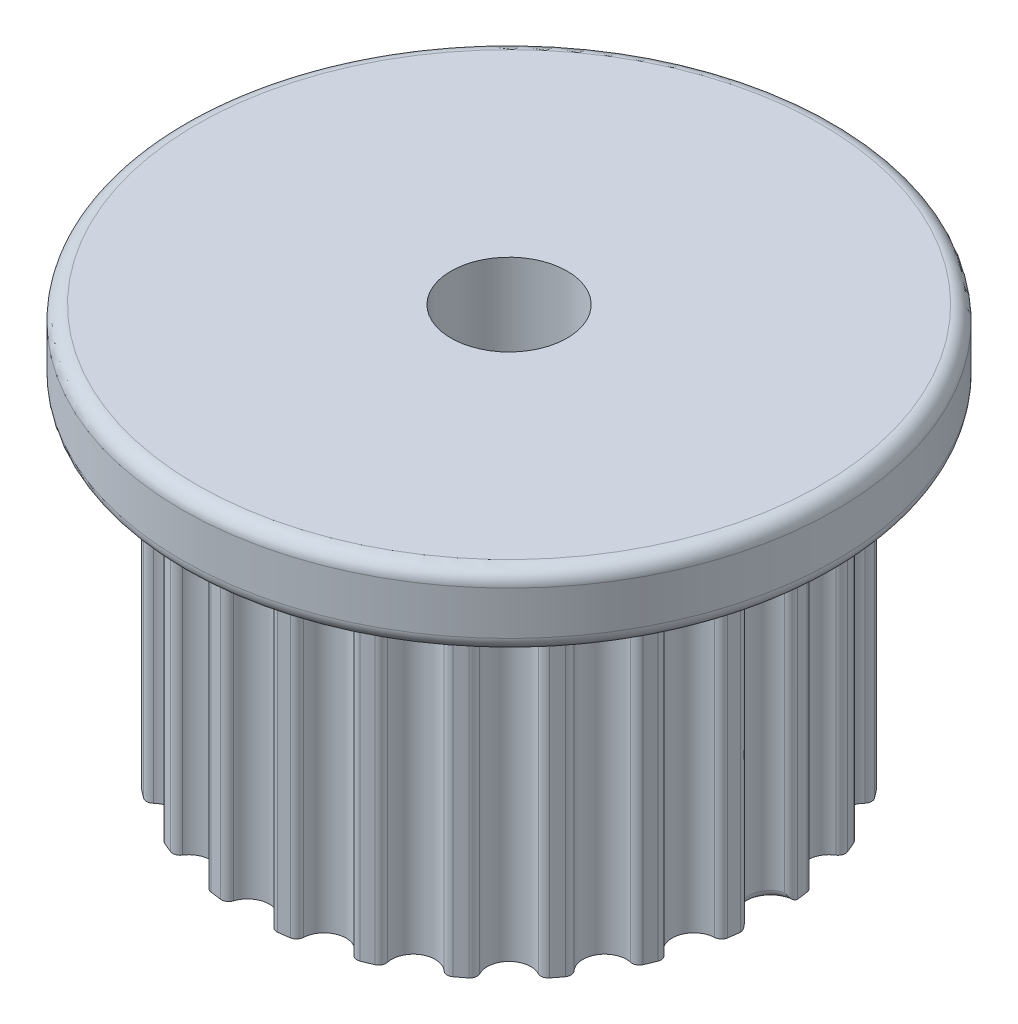
from build123d import *

# Parameters (mm, degrees)
ESBO_O1_R                = 4.5
RESSALTO_EXTRUS_O1_DEPTH = 1
ESBO_O4_R                = 3.6
ESBO_O4_R_2              = 0.8
RESSALTO_EXTRUS_O3_DEPTH = 4.5
ESBO_O5_R                = 0.3
CORTE_EXTRUS_O2_DEPTH    = 4.5
FILETE2_R                = 0.1
ESBO_O6_R                = 0.8
CORTE_EXTRUS_O3_DEPTH    = 8.794228692
FILETE3_R                = 0.2


with BuildPart() as part:
    # Esboço1 → Ressalto-extrusão1 (new body)
    with BuildSketch(Plane(origin=(0, 0, 0), x_dir=(1, 0, 0), z_dir=(0, 1, 0))):
        with Locations(Location((0, 0, 0), (0, 0, 270))):
            Circle(ESBO_O1_R)
    extrude(amount=RESSALTO_EXTRUS_O1_DEPTH)

    # Esboço4 → Ressalto-extrusão3 (add)
    with BuildSketch(Plane.XZ):
        with Locations(Location((0, 0, 0), (0, 0, 90))):
            Circle(ESBO_O4_R)
        with Locations(Location((0, 0, 0), (0, 0, 270))):
            Circle(ESBO_O4_R_2, mode=Mode.SUBTRACT)
    extrude(amount=RESSALTO_EXTRUS_O3_DEPTH)

    # Esboço5 → Corte-extrusão2 (cut)
    with BuildSketch(Plane.XZ.offset(4.5)):
        with Locations((0, 3.6)):
            Circle(ESBO_O5_R)
        with Locations((0.931748562, 3.477332975)):
            Circle(ESBO_O5_R)
        with Locations((1.8, 3.117691454)):
            Circle(ESBO_O5_R)
        with Locations((2.545584412, 2.545584412)):
            Circle(ESBO_O5_R)
        with Locations((3.117691454, 1.8)):
            Circle(ESBO_O5_R)
        with Locations((3.477332975, 0.931748562)):
            Circle(ESBO_O5_R)
        with Locations((3.6, 0)):
            Circle(ESBO_O5_R)
        with Locations((3.477332975, -0.931748562)):
            Circle(ESBO_O5_R)
        with Locations((3.117691454, -1.8)):
            Circle(ESBO_O5_R)
        with Locations((2.545584412, -2.545584412)):
            Circle(ESBO_O5_R)
        with Locations((1.8, -3.117691454)):
            Circle(ESBO_O5_R)
        with Locations((0.931748562, -3.477332975)):
            Circle(ESBO_O5_R)
        with Locations((0, -3.6)):
            Circle(ESBO_O5_R)
        with Locations((-0.931748562, -3.477332975)):
            Circle(ESBO_O5_R)
        with Locations((-1.8, -3.117691454)):
            Circle(ESBO_O5_R)
        with Locations((-2.545584412, -2.545584412)):
            Circle(ESBO_O5_R)
        with Locations((-3.117691454, -1.8)):
            Circle(ESBO_O5_R)
        with Locations((-3.477332975, -0.931748562)):
            Circle(ESBO_O5_R)
        with Locations((-3.6, 0)):
            Circle(ESBO_O5_R)
        with Locations((-3.477332975, 0.931748562)):
            Circle(ESBO_O5_R)
        with Locations((-3.117691454, 1.8)):
            Circle(ESBO_O5_R)
        with Locations((-2.545584412, 2.545584412)):
            Circle(ESBO_O5_R)
        with Locations((-1.8, 3.117691454)):
            Circle(ESBO_O5_R)
        with Locations((-0.931748562, 3.477332975)):
            Circle(ESBO_O5_R)
    extrude(amount=-CORTE_EXTRUS_O2_DEPTH, mode=Mode.SUBTRACT)

    # Filete2
    filete2_edges = [part.edges().sort_by_distance(p)[0] for p in [
        (-2.857883832, 0, -1.65),
        (-2.333452378, 0, -2.333452378),
        (-1.65, 0, -2.857883832),
        (-0.854102849, 0, -3.187555227),
        (0, 0, -3.3),
        (0.854102849, 0, -3.187555227),
        (1.65, 0, -2.857883832),
        (2.333452378, 0, -2.333452378),
        (2.857883832, 0, -1.65),
        (3.187555227, 0, -0.854102849),
        (3.3, -4.5, 0),
        (3.3, 0, 0),
        (3.187555227, 0, 0.854102849),
        (2.857883832, 0, 1.65),
        (2.333452378, 0, 2.333452378),
        (1.65, 0, 2.857883832),
        (0.854102849, 0, 3.187555227),
        (-3.187555227, 0, -0.854102849),
        (-3.3, 0, 0),
        (-3.187555227, 0, 0.854102849),
        (-2.857883832, 0, 1.65),
        (-2.333452378, 0, 2.333452378),
        (-1.65, 0, 2.857883832),
        (-0.854102849, 0, 3.187555227),
        (0, 0, 3.3),
        (-1.377660357, 0, 3.325966317),
        (-2.191541144, 0, 2.856072025),
        (-2.856072025, 0, 2.191541144),
        (-3.325966317, 0, 1.377660357),
        (-3.569201501, 0, 0.469894292),
        (-3.569201501, 0, -0.469894292),
        (-3.325966317, 0, -1.377660357),
        (-2.856072025, 0, -2.191541144),
        (-2.191541144, 0, -2.856072025),
        (-1.377660357, 0, -3.325966317),
        (-0.469894292, 0, -3.569201501),
        (0.469894292, 0, -3.569201501),
        (1.377660357, 0, -3.325966317),
        (2.191541144, 0, -2.856072025),
        (2.856072025, 0, -2.191541144),
        (3.325966317, 0, -1.377660357),
        (3.569201501, 0, -0.469894292),
        (3.569201501, 0, 0.469894292),
        (3.325966317, 0, 1.377660357),
        (2.856072025, 0, 2.191541144),
        (2.191541144, 0, 2.856072025),
        (1.377660357, 0, 3.325966317),
        (0.469894292, 0, 3.569201501),
        (-0.29973947, -2.25, 3.5875),
        (0.29973947, -2.25, 3.5875),
        (-1.21803942, -2.25, 3.387680618),
        (-0.638987229, -2.25, 3.542837185),
        (-2.053331996, -2.25, 2.956996401),
        (-1.534168004, -2.25, 3.256735871),
        (-2.748693389, -2.25, 2.324797766),
        (-2.324797766, -2.25, 2.748693389),
        (-3.256735871, -2.25, 1.534168004),
        (-2.956996401, -2.25, 2.053331996),
        (-3.542837185, -2.25, 0.638987229),
        (-3.387680618, -2.25, 1.21803942),
        (-3.5875, -2.25, -0.29973947),
        (-3.5875, -2.25, 0.29973947),
        (-3.387680618, -2.25, -1.21803942),
        (-3.542837185, -2.25, -0.638987229),
        (0.638987229, -2.25, 3.542837185),
        (1.21803942, -2.25, 3.387680618),
        (1.534168004, -2.25, 3.256735871),
        (2.053331996, -2.25, 2.956996401),
        (2.324797766, -2.25, 2.748693389),
        (2.748693389, -2.25, 2.324797766),
        (2.956996401, -2.25, 2.053331996),
        (3.256735871, -2.25, 1.534168004),
        (3.387680618, -2.25, 1.21803942),
        (3.542837185, -2.25, 0.638987229),
        (3.5875, -2.25, 0.29973947),
        (3.5875, -2.25, -0.29973947),
        (3.542837185, -2.25, -0.638987229),
        (3.387680618, -2.25, -1.21803942),
        (3.256735871, -2.25, -1.534168004),
        (2.956996401, -2.25, -2.053331996),
        (2.748693389, -2.25, -2.324797766),
        (2.324797766, -2.25, -2.748693389),
        (2.053331996, -2.25, -2.956996401),
        (1.534168004, -2.25, -3.256735871),
        (1.21803942, -2.25, -3.387680618),
        (0.638987229, -2.25, -3.542837185),
        (0.29973947, -2.25, -3.5875),
        (-0.29973947, -2.25, -3.5875),
        (-0.469894292, 0, 3.569201501),
        (-0.638987229, -2.25, -3.542837185),
        (-1.21803942, -2.25, -3.387680618),
        (-1.534168004, -2.25, -3.256735871),
        (-2.053331996, -2.25, -2.956996401),
        (-2.324797766, -2.25, -2.748693389),
        (-2.748693389, -2.25, -2.324797766),
        (-2.956996401, -2.25, -2.053331996),
        (-3.256735871, -2.25, -1.534168004),
    ]]
    fillet(filete2_edges, radius=FILETE2_R)

    # Esboço6 → Corte-extrusão3 (cut, through all)
    with BuildSketch(Plane.XZ):
        with Locations(Location((0, 0, 0), (0, 0, 270))):
            Circle(ESBO_O6_R)
    extrude(amount=-CORTE_EXTRUS_O3_DEPTH, mode=Mode.SUBTRACT)

    # Filete3
    filete3_edges = [part.edges().sort_by_distance(p)[0] for p in [
        (0, 0, -4.5),
        (0, 1, -4.5),
    ]]
    fillet(filete3_edges, radius=FILETE3_R)


solid = part.part
